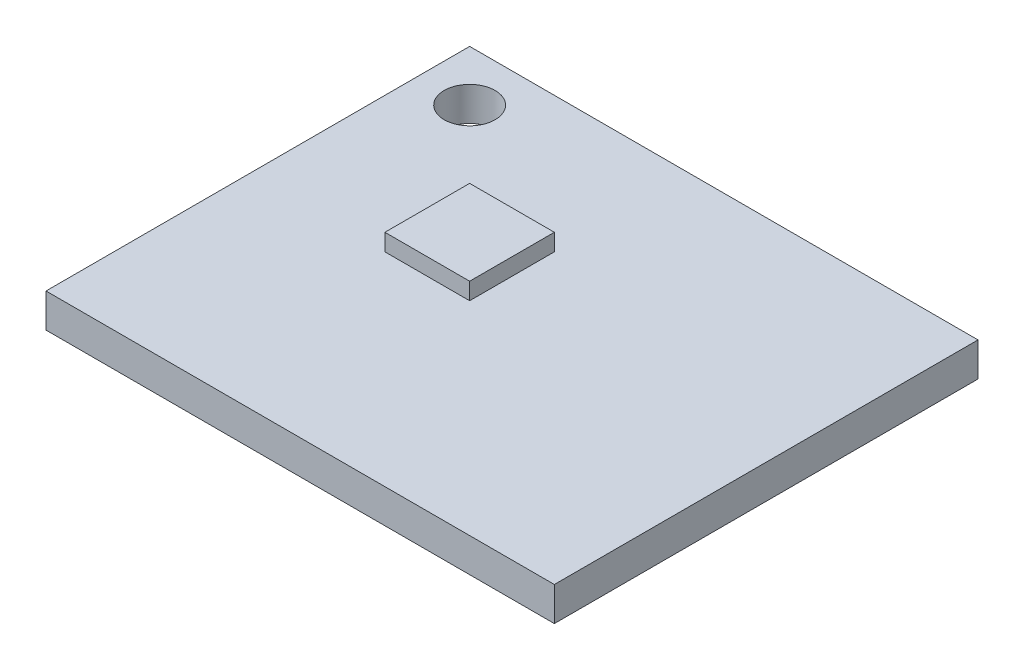
from build123d import *

# Parameters (mm, degrees)
SKETCH1_W           = 30
SKETCH1_H           = 25
BOSS_EXTRUDE1_DEPTH = 2
SKETCH2_W           = 5
SKETCH2_H           = 5
BOSS_EXTRUDE2_DEPTH = 1
SKETCH3_R           = 1.5
CUT_EXTRUDE1_DEPTH  = 4


with BuildPart() as part:
    # Sketch1 → Boss-Extrude1 (new body)
    with BuildSketch(Plane(origin=(0, 0, 0), x_dir=(1, 0, 0), z_dir=(0, 1, 0))):
        with Locations((15, 12.5)):
            Rectangle(SKETCH1_W, SKETCH1_H)
    extrude(amount=BOSS_EXTRUDE1_DEPTH)

    # Sketch2 → Boss-Extrude2 (add)
    with BuildSketch(Plane(origin=(0, 2, 0), x_dir=(1, 0, 0), z_dir=(0, 1, 0))):
        with Locations((10.5, 14.5)):
            Rectangle(SKETCH2_W, SKETCH2_H)
    extrude(amount=BOSS_EXTRUDE2_DEPTH)

    # Sketch3 → Cut-Extrude1 (cut)
    with BuildSketch(Plane(origin=(0, 2, 0), x_dir=(1, 0, 0), z_dir=(0, 1, 0))):
        with Locations(Location((3, 22, 0), (0, 0, 270))):
            Circle(SKETCH3_R)
    extrude(amount=-CUT_EXTRUDE1_DEPTH, mode=Mode.SUBTRACT)


solid = part.part
